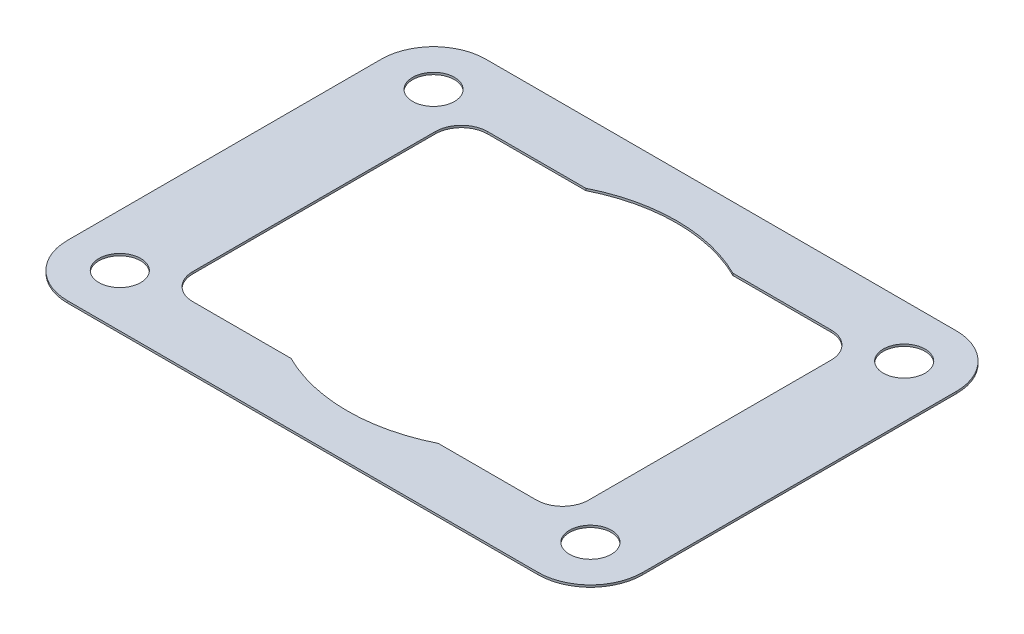
from build123d import *

# Parameters (mm, degrees)
SKETCH1_W               = 139.7
SKETCH1_H               = 101.6
BOSS_EXTRUDE1_DEPTH     = 0.508
FILLET1_R               = 12.7
SKETCH2_W               = 96.139
SKETCH2_H               = 71.5772
CUT_EXTRUDE1_DEPTH      = 87.370831674
FILLET2_R               = 6.35
SKETCH3_R               = 5.08
CUT_EXTRUDE2_DEPTH      = 87.370831674
MIRROR2_COPY_1_SKETCH_R = 5.08
MIRROR2_COPY_1_DEPTH    = 87.370831674
SKETCH4_R               = 40.005
CUT_EXTRUDE3_DEPTH      = 87.370831674


with BuildPart() as part:
    # Sketch1 → Boss-Extrude1 (new body)
    with BuildSketch(Plane(origin=(0, 0, 0), x_dir=(1, 0, 0), z_dir=(0, 1, 0))):
        Rectangle(SKETCH1_W, SKETCH1_H)
    extrude(amount=BOSS_EXTRUDE1_DEPTH)

    # Fillet1
    fillet1_edges = [part.edges().sort_by_distance(p)[0] for p in [
        (-69.85, 0.254, -50.8),
        (69.85, 0.254, -50.8),
        (69.85, 0.254, 50.8),
        (-69.85, 0.254, 50.8),
    ]]
    fillet(fillet1_edges, radius=FILLET1_R)

    # Sketch2 → Cut-Extrude1 (cut, through all)
    with BuildSketch(Plane(origin=(0, 0.508, 0), x_dir=(1, 0, 0), z_dir=(0, 1, 0))):
        Rectangle(SKETCH2_W, SKETCH2_H)
    extrude(amount=-CUT_EXTRUDE1_DEPTH, mode=Mode.SUBTRACT)

    # Fillet2
    fillet2_edges = [part.edges().sort_by_distance(p)[0] for p in [
        (-48.0695, 0.254, 35.7886),
        (-48.0695, 0.254, -35.7886),
        (48.0695, 0.254, -35.7886),
        (48.0695, 0.254, 35.7886),
    ]]
    fillet(fillet2_edges, radius=FILLET2_R)

    # Sketch3 → Cut-Extrude2 (cut, through all)
    with BuildSketch(Plane(origin=(0, 0.508, 0), x_dir=(1, 0, 0), z_dir=(0, 1, 0))):
        with Locations(Location((-57.15, 38.1, 0), (0, 0, 270))):
            Circle(SKETCH3_R)
    cut_extrude2 = extrude(amount=-CUT_EXTRUDE2_DEPTH, mode=Mode.SUBTRACT)

    # Mirror1: Cut-Extrude2 across plane
    add(cut_extrude2.mirror(Plane(origin=(0, 0, 0), x_dir=(0, 0, 1), z_dir=(1, 0, 0))), mode=Mode.SUBTRACT)

    # Mirror2: Cut-Extrude2 across plane
    add(cut_extrude2.mirror(Plane.XY), mode=Mode.SUBTRACT)

    # Mirror2 copy 1 sketch → Mirror2 copy 1 (cut, through all)
    with BuildSketch(Plane(origin=(0, 0.508, 0), x_dir=(-1, 0, 0), z_dir=(0, 1, 0))):
        with Locations(Location((-57.15, 38.1, 0), (0, 0, 270))):
            Circle(MIRROR2_COPY_1_SKETCH_R)
    extrude(amount=-MIRROR2_COPY_1_DEPTH, mode=Mode.SUBTRACT)

    # Sketch4 → Cut-Extrude3 (cut, through all)
    with BuildSketch(Plane(origin=(0, 0.508, 0), x_dir=(1, 0, 0), z_dir=(0, 1, 0))):
        Circle(SKETCH4_R)
    extrude(amount=-CUT_EXTRUDE3_DEPTH, mode=Mode.SUBTRACT)


solid = part.part
